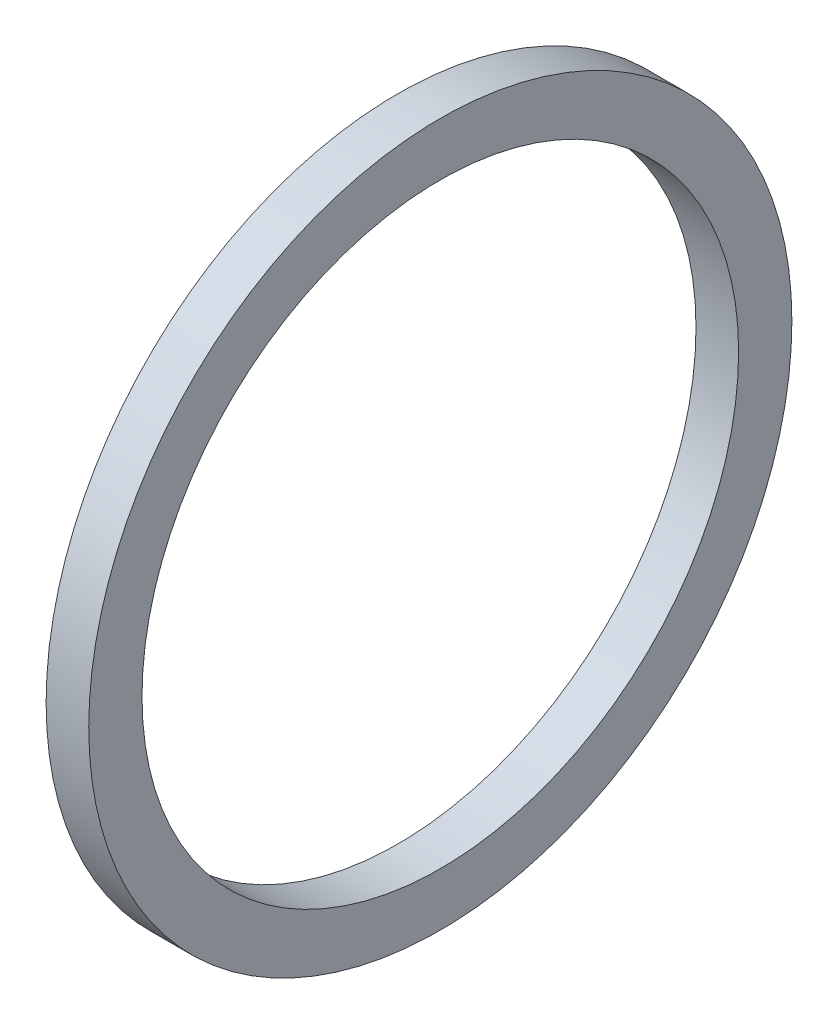
from build123d import *

# Parameters (mm, degrees)
AXIAL_PROFILE_MM_W = 2
AXIAL_PROFILE_MM_H = 2.5


with BuildPart() as part:
    # Axial profile (mm) → Full revolution (revolve)
    with BuildSketch(Plane.XY, mode=Mode.PRIVATE) as full_revolution_sk:
        with Locations((0, 15.25)):
            Rectangle(AXIAL_PROFILE_MM_W, AXIAL_PROFILE_MM_H)
    revolve(full_revolution_sk.sketch.rotate(Axis((-110, 0, 0), (1, 0, 0)), 90), axis=Axis((-110, 0, 0), (1, 0, 0)))


solid = part.part
